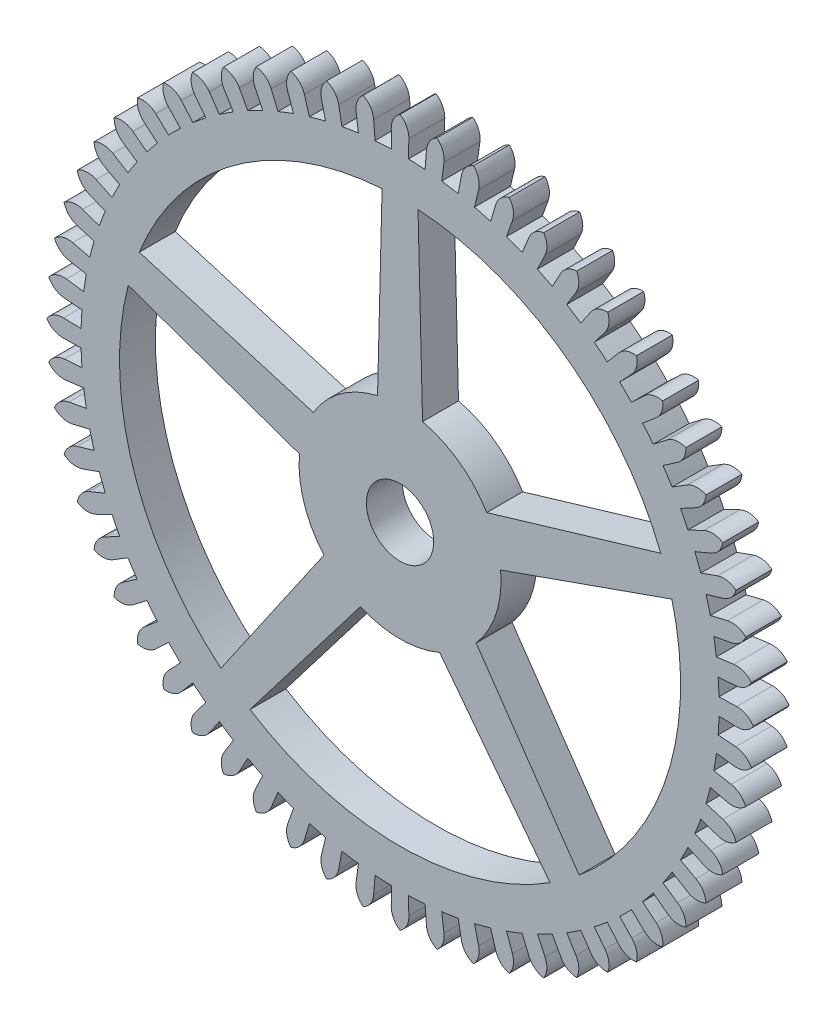
from build123d import *

# Parameters (mm, degrees)
SKETCH1_R           = 0.75
BOSS_EXTRUDE1_DEPTH = 0.8


with BuildPart() as part:
    # Sketch1 → Boss-Extrude1 (new body)
    with BuildSketch(Plane.XY):
        with BuildLine():
            ThreePointArc((0.196333177, 7.497429778), (0.146842868, 7.709365809), (0, 7.87))
            ThreePointArc((0, 7.87), (-0.146842868, 7.709365809), (-0.196333177, 7.497429778))
            Line((-0.196333177, 7.497429778), (-0.186053172, 7.104864355))
            ThreePointArc((-0.186053172, 7.104864355), (-0.371967342, 7.097559692), (-0.5576266, 7.085391017))
            Line((-0.5576266, 7.085391017), (-0.58843717, 7.476880479))
            ThreePointArc((-0.58843717, 7.476880479), (-0.659809713, 7.682482355), (-0.822639006, 7.826887317))
            ThreePointArc((-0.822639006, 7.826887317), (-0.951886609, 7.651783837), (-0.978952457, 7.435835668))
            Line((-0.978952457, 7.435835668), (-0.927694506, 7.046495313))
            ThreePointArc((-0.927694506, 7.046495313), (-1.111826673, 7.019797343), (-1.295196897, 6.988288652))
            Line((-1.295196897, 6.988288652), (-1.366760476, 7.374412912))
            ThreePointArc((-1.366760476, 7.374412912), (-1.459233281, 7.571428018), (-1.636265007, 7.698021618))
            ThreePointArc((-1.636265007, 7.698021618), (-1.74650128, 7.51036732), (-1.750846128, 7.292772987))
            Line((-1.750846128, 7.292772987), (-1.659171825, 6.910923393))
            ThreePointArc((-1.659171825, 6.910923393), (-1.839504599, 6.865124625), (-2.018576747, 6.814621135))
            Line((-2.018576747, 6.814621135), (-2.130109268, 7.191149735))
            ThreePointArc((-2.130109268, 7.191149735), (-2.242669184, 7.377419531), (-2.431963746, 7.484814783))
            ThreePointArc((-2.431963746, 7.484814783), (-2.521980918, 7.286665647), (-2.503557163, 7.069809158))
            Line((-2.503557163, 7.069809158), (-2.37247091, 6.69963395))
            ThreePointArc((-2.37247091, 6.69963395), (-2.547028528, 6.635236165), (-2.719840647, 6.566291202))
            Line((-2.719840647, 6.566291202), (-2.870120138, 6.929098816))
            ThreePointArc((-2.870120138, 6.929098816), (-3.001533934, 7.102582491), (-3.201017381, 7.189602752))
            ThreePointArc((-3.201017381, 7.189602752), (-3.269829205, 6.98312974), (-3.228838702, 6.769387021))
            Line((-3.228838702, 6.769387021), (-3.059776708, 6.414941916))
            ThreePointArc((-3.059776708, 6.414941916), (-3.226646679, 6.332650669), (-3.391305404, 6.246019608))
            Line((-3.391305404, 6.246019608), (-3.57868537, 6.59113124))
            ThreePointArc((-3.57868537, 6.59113124), (-3.72751325, 6.749928072), (-3.935, 6.815619928))
            ThreePointArc((-3.935, 6.815619928), (-3.981852559, 6.603085203), (-3.918744408, 6.394798063))
            Line((-3.918744408, 6.394798063), (-3.713558951, 6.059966436))
            ThreePointArc((-3.713558951, 6.059966436), (-3.870913014, 5.960683328), (-4.02561431, 5.857315317))
            Line((-4.02561431, 5.857315317), (-4.248041777, 6.180949851))
            ThreePointArc((-4.248041777, 6.180949851), (-4.412653151, 6.323320027), (-4.625869936, 6.366963746))
            ThreePointArc((-4.625869936, 6.366963746), (-4.650249903, 6.150695882), (-4.565715531, 5.950146359))
            Line((-4.565715531, 5.950146359), (-4.326654666, 5.638596696))
            ThreePointArc((-4.326654666, 5.638596696), (-4.472768815, 5.523409492), (-4.615817742, 5.404437053))
            Line((-4.615817742, 5.404437053), (-4.870855749, 5.703048682))
            ThreePointArc((-4.870855749, 5.703048682), (-5.0494471, 5.827432366), (-5.266057872, 5.848549777))
            ThreePointArc((-5.266057872, 5.848549777), (-5.267698136, 5.630918251), (-5.162663719, 5.440303606))
            Line((-5.162663719, 5.440303606), (-4.892346646, 5.15544931))
            ThreePointArc((-4.892346646, 5.15544931), (-5.025620026, 5.025620026), (-5.15544931, 4.892346646))
            Line((-5.15544931, 4.892346646), (-5.440303606, 5.162663719))
            ThreePointArc((-5.440303606, 5.162663719), (-5.630918251, 5.267698136), (-5.848549777, 5.266057872))
            ThreePointArc((-5.848549777, 5.266057872), (-5.827432366, 5.0494471), (-5.703048682, 4.870855749))
            Line((-5.703048682, 4.870855749), (-5.404437053, 4.615817742))
            ThreePointArc((-5.404437053, 4.615817742), (-5.523409492, 4.472768815), (-5.638596696, 4.326654666))
            Line((-5.638596696, 4.326654666), (-5.950146359, 4.565715531))
            ThreePointArc((-5.950146359, 4.565715531), (-6.150695882, 4.650249903), (-6.366963746, 4.625869936))
            ThreePointArc((-6.366963746, 4.625869936), (-6.323320027, 4.412653151), (-6.180949851, 4.248041777))
            Line((-6.180949851, 4.248041777), (-5.857315317, 4.02561431))
            ThreePointArc((-5.857315317, 4.02561431), (-5.960683328, 3.870913014), (-6.059966436, 3.713558951))
            Line((-6.059966436, 3.713558951), (-6.394798063, 3.918744408))
            ThreePointArc((-6.394798063, 3.918744408), (-6.603085203, 3.981852559), (-6.815619928, 3.935))
            ThreePointArc((-6.815619928, 3.935), (-6.749928072, 3.72751325), (-6.59113124, 3.57868537))
            Line((-6.59113124, 3.57868537), (-6.246019608, 3.391305404))
            ThreePointArc((-6.246019608, 3.391305404), (-6.332650669, 3.226646679), (-6.414941916, 3.059776708))
            Line((-6.414941916, 3.059776708), (-6.769387021, 3.228838702))
            ThreePointArc((-6.769387021, 3.228838702), (-6.98312974, 3.269829205), (-7.189602752, 3.201017381))
            ThreePointArc((-7.189602752, 3.201017381), (-7.102582491, 3.001533934), (-6.929098816, 2.870120138))
            Line((-6.929098816, 2.870120138), (-6.566291202, 2.719840647))
            ThreePointArc((-6.566291202, 2.719840647), (-6.635236165, 2.547028528), (-6.69963395, 2.37247091))
            Line((-6.69963395, 2.37247091), (-7.069809158, 2.503557163))
            ThreePointArc((-7.069809158, 2.503557163), (-7.286665647, 2.521980918), (-7.484814783, 2.431963746))
            ThreePointArc((-7.484814783, 2.431963746), (-7.377419531, 2.242669184), (-7.191149735, 2.130109268))
            Line((-7.191149735, 2.130109268), (-6.814621135, 2.018576747))
            ThreePointArc((-6.814621135, 2.018576747), (-6.865124625, 1.839504599), (-6.910923393, 1.659171825))
            Line((-6.910923393, 1.659171825), (-7.292772987, 1.750846128))
            ThreePointArc((-7.292772987, 1.750846128), (-7.51036732, 1.74650128), (-7.698021618, 1.636265007))
            ThreePointArc((-7.698021618, 1.636265007), (-7.571428018, 1.459233281), (-7.374412912, 1.366760476))
            Line((-7.374412912, 1.366760476), (-6.988288652, 1.295196897))
            ThreePointArc((-6.988288652, 1.295196897), (-7.019797343, 1.111826673), (-7.046495313, 0.927694506))
            Line((-7.046495313, 0.927694506), (-7.435835668, 0.978952457))
            ThreePointArc((-7.435835668, 0.978952457), (-7.651783837, 0.951886609), (-7.826887317, 0.822639006))
            ThreePointArc((-7.826887317, 0.822639006), (-7.682482355, 0.659809713), (-7.476880479, 0.58843717))
            Line((-7.476880479, 0.58843717), (-7.085391017, 0.5576266))
            ThreePointArc((-7.085391017, 0.5576266), (-7.097559692, 0.371967342), (-7.104864355, 0.186053172))
            Line((-7.104864355, 0.186053172), (-7.497429779, 0.196333177))
            ThreePointArc((-7.497429779, 0.196333177), (-7.709365809, 0.146842868), (-7.87, 0))
            ThreePointArc((-7.87, 0), (-7.709365809, -0.146842868), (-7.497429779, -0.196333177))
            Line((-7.497429779, -0.196333177), (-7.104864355, -0.186053172))
            ThreePointArc((-7.104864355, -0.186053172), (-7.097559692, -0.371967342), (-7.085391017, -0.5576266))
            Line((-7.085391017, -0.5576266), (-7.476880479, -0.58843717))
            ThreePointArc((-7.476880479, -0.58843717), (-7.682482355, -0.659809713), (-7.826887317, -0.822639006))
            ThreePointArc((-7.826887317, -0.822639006), (-7.651783837, -0.951886609), (-7.435835668, -0.978952457))
            Line((-7.435835668, -0.978952457), (-7.046495313, -0.927694506))
            ThreePointArc((-7.046495313, -0.927694506), (-7.019797343, -1.111826673), (-6.988288652, -1.295196897))
            Line((-6.988288652, -1.295196897), (-7.374412912, -1.366760476))
            ThreePointArc((-7.374412912, -1.366760476), (-7.571428018, -1.459233281), (-7.698021618, -1.636265007))
            ThreePointArc((-7.698021618, -1.636265007), (-7.51036732, -1.74650128), (-7.292772987, -1.750846128))
            Line((-7.292772987, -1.750846128), (-6.910923393, -1.659171825))
            ThreePointArc((-6.910923393, -1.659171825), (-6.865124625, -1.839504599), (-6.814621135, -2.018576747))
            Line((-6.814621135, -2.018576747), (-7.191149735, -2.130109268))
            ThreePointArc((-7.191149735, -2.130109268), (-7.377419531, -2.242669184), (-7.484814783, -2.431963746))
            ThreePointArc((-7.484814783, -2.431963746), (-7.286665647, -2.521980918), (-7.069809158, -2.503557163))
            Line((-7.069809158, -2.503557163), (-6.69963395, -2.37247091))
            ThreePointArc((-6.69963395, -2.37247091), (-6.635236165, -2.547028528), (-6.566291202, -2.719840647))
            Line((-6.566291202, -2.719840647), (-6.929098816, -2.870120138))
            ThreePointArc((-6.929098816, -2.870120138), (-7.102582491, -3.001533934), (-7.189602752, -3.201017381))
            ThreePointArc((-7.189602752, -3.201017381), (-6.98312974, -3.269829205), (-6.769387021, -3.228838702))
            Line((-6.769387021, -3.228838702), (-6.414941916, -3.059776708))
            ThreePointArc((-6.414941916, -3.059776708), (-6.332650669, -3.226646679), (-6.246019608, -3.391305404))
            Line((-6.246019608, -3.391305404), (-6.59113124, -3.57868537))
            ThreePointArc((-6.59113124, -3.57868537), (-6.749928072, -3.72751325), (-6.815619928, -3.935))
            ThreePointArc((-6.815619928, -3.935), (-6.603085203, -3.981852559), (-6.394798063, -3.918744408))
            Line((-6.394798063, -3.918744408), (-6.059966436, -3.713558951))
            ThreePointArc((-6.059966436, -3.713558951), (-5.960683328, -3.870913014), (-5.857315317, -4.02561431))
            Line((-5.857315317, -4.02561431), (-6.180949851, -4.248041777))
            ThreePointArc((-6.180949851, -4.248041777), (-6.323320027, -4.412653151), (-6.366963746, -4.625869936))
            ThreePointArc((-6.366963746, -4.625869936), (-6.150695882, -4.650249903), (-5.950146359, -4.565715531))
            Line((-5.950146359, -4.565715531), (-5.638596696, -4.326654666))
            ThreePointArc((-5.638596696, -4.326654666), (-5.523409492, -4.472768815), (-5.404437053, -4.615817742))
            Line((-5.404437053, -4.615817742), (-5.703048682, -4.870855749))
            ThreePointArc((-5.703048682, -4.870855749), (-5.827432366, -5.0494471), (-5.848549777, -5.266057872))
            ThreePointArc((-5.848549777, -5.266057872), (-5.630918251, -5.267698136), (-5.440303606, -5.162663719))
            Line((-5.440303606, -5.162663719), (-5.15544931, -4.892346646))
            ThreePointArc((-5.15544931, -4.892346646), (-5.025620026, -5.025620026), (-4.892346646, -5.15544931))
            Line((-4.892346646, -5.15544931), (-5.162663719, -5.440303606))
            ThreePointArc((-5.162663719, -5.440303606), (-5.267698136, -5.630918251), (-5.266057872, -5.848549777))
            ThreePointArc((-5.266057872, -5.848549777), (-5.0494471, -5.827432366), (-4.870855749, -5.703048682))
            Line((-4.870855749, -5.703048682), (-4.615817742, -5.404437053))
            ThreePointArc((-4.615817742, -5.404437053), (-4.472768815, -5.523409492), (-4.326654666, -5.638596696))
            Line((-4.326654666, -5.638596696), (-4.565715531, -5.950146359))
            ThreePointArc((-4.565715531, -5.950146359), (-4.650249903, -6.150695882), (-4.625869936, -6.366963746))
            ThreePointArc((-4.625869936, -6.366963746), (-4.412653151, -6.323320027), (-4.248041777, -6.180949851))
            Line((-4.248041777, -6.180949851), (-4.02561431, -5.857315317))
            ThreePointArc((-4.02561431, -5.857315317), (-3.870913014, -5.960683328), (-3.713558951, -6.059966436))
            Line((-3.713558951, -6.059966436), (-3.918744408, -6.394798063))
            ThreePointArc((-3.918744408, -6.394798063), (-3.981852559, -6.603085203), (-3.935, -6.815619928))
            ThreePointArc((-3.935, -6.815619928), (-3.72751325, -6.749928072), (-3.57868537, -6.59113124))
            Line((-3.57868537, -6.59113124), (-3.391305404, -6.246019608))
            ThreePointArc((-3.391305404, -6.246019608), (-3.226646679, -6.332650669), (-3.059776708, -6.414941916))
            Line((-3.059776708, -6.414941916), (-3.228838702, -6.769387021))
            ThreePointArc((-3.228838702, -6.769387021), (-3.269829205, -6.98312974), (-3.201017381, -7.189602752))
            ThreePointArc((-3.201017381, -7.189602752), (-3.001533934, -7.102582491), (-2.870120138, -6.929098816))
            Line((-2.870120138, -6.929098816), (-2.719840647, -6.566291202))
            ThreePointArc((-2.719840647, -6.566291202), (-2.547028528, -6.635236165), (-2.37247091, -6.69963395))
            Line((-2.37247091, -6.69963395), (-2.503557163, -7.069809158))
            ThreePointArc((-2.503557163, -7.069809158), (-2.521980918, -7.286665647), (-2.431963746, -7.484814783))
            ThreePointArc((-2.431963746, -7.484814783), (-2.242669184, -7.377419531), (-2.130109268, -7.191149735))
            Line((-2.130109268, -7.191149735), (-2.018576747, -6.814621135))
            ThreePointArc((-2.018576747, -6.814621135), (-1.839504599, -6.865124625), (-1.659171825, -6.910923393))
            Line((-1.659171825, -6.910923393), (-1.750846128, -7.292772987))
            ThreePointArc((-1.750846128, -7.292772987), (-1.74650128, -7.51036732), (-1.636265007, -7.698021618))
            ThreePointArc((-1.636265007, -7.698021618), (-1.459233281, -7.571428018), (-1.366760476, -7.374412912))
            Line((-1.366760476, -7.374412912), (-1.295196897, -6.988288652))
            ThreePointArc((-1.295196897, -6.988288652), (-1.111826673, -7.019797343), (-0.927694506, -7.046495313))
            Line((-0.927694506, -7.046495313), (-0.978952457, -7.435835668))
            ThreePointArc((-0.978952457, -7.435835668), (-0.951886609, -7.651783837), (-0.822639006, -7.826887317))
            ThreePointArc((-0.822639006, -7.826887317), (-0.659809713, -7.682482355), (-0.58843717, -7.476880479))
            Line((-0.58843717, -7.476880479), (-0.5576266, -7.085391017))
            ThreePointArc((-0.5576266, -7.085391017), (-0.371967342, -7.097559692), (-0.186053172, -7.104864355))
            Line((-0.186053172, -7.104864355), (-0.196333177, -7.497429779))
            ThreePointArc((-0.196333177, -7.497429779), (-0.146842868, -7.709365809), (0, -7.87))
            ThreePointArc((0, -7.87), (0.146842868, -7.709365809), (0.196333177, -7.497429779))
            Line((0.196333177, -7.497429779), (0.186053172, -7.104864355))
            ThreePointArc((0.186053172, -7.104864355), (0.371967342, -7.097559692), (0.5576266, -7.085391017))
            Line((0.5576266, -7.085391017), (0.58843717, -7.476880479))
            ThreePointArc((0.58843717, -7.476880479), (0.659809713, -7.682482355), (0.822639006, -7.826887317))
            ThreePointArc((0.822639006, -7.826887317), (0.951886609, -7.651783837), (0.978952457, -7.435835668))
            Line((0.978952457, -7.435835668), (0.927694506, -7.046495313))
            ThreePointArc((0.927694506, -7.046495313), (1.111826673, -7.019797343), (1.295196897, -6.988288652))
            Line((1.295196897, -6.988288652), (1.366760476, -7.374412912))
            ThreePointArc((1.366760476, -7.374412912), (1.459233281, -7.571428018), (1.636265007, -7.698021618))
            ThreePointArc((1.636265007, -7.698021618), (1.74650128, -7.51036732), (1.750846128, -7.292772987))
            Line((1.750846128, -7.292772987), (1.659171825, -6.910923393))
            ThreePointArc((1.659171825, -6.910923393), (1.839504599, -6.865124625), (2.018576747, -6.814621135))
            Line((2.018576747, -6.814621135), (2.130109268, -7.191149735))
            ThreePointArc((2.130109268, -7.191149735), (2.242669184, -7.377419531), (2.431963746, -7.484814783))
            ThreePointArc((2.431963746, -7.484814783), (2.521980918, -7.286665647), (2.503557163, -7.069809158))
            Line((2.503557163, -7.069809158), (2.37247091, -6.69963395))
            ThreePointArc((2.37247091, -6.69963395), (2.547028528, -6.635236165), (2.719840647, -6.566291202))
            Line((2.719840647, -6.566291202), (2.870120138, -6.929098816))
            ThreePointArc((2.870120138, -6.929098816), (3.001533934, -7.102582491), (3.201017381, -7.189602752))
            ThreePointArc((3.201017381, -7.189602752), (3.269829205, -6.98312974), (3.228838702, -6.769387021))
            Line((3.228838702, -6.769387021), (3.059776708, -6.414941916))
            ThreePointArc((3.059776708, -6.414941916), (3.226646679, -6.332650669), (3.391305404, -6.246019608))
            Line((3.391305404, -6.246019608), (3.57868537, -6.59113124))
            ThreePointArc((3.57868537, -6.59113124), (3.72751325, -6.749928072), (3.935, -6.815619928))
            ThreePointArc((3.935, -6.815619928), (3.981852559, -6.603085203), (3.918744408, -6.394798063))
            Line((3.918744408, -6.394798063), (3.713558951, -6.059966436))
            ThreePointArc((3.713558951, -6.059966436), (3.870913014, -5.960683328), (4.02561431, -5.857315317))
            Line((4.02561431, -5.857315317), (4.248041777, -6.180949851))
            ThreePointArc((4.248041777, -6.180949851), (4.412653151, -6.323320027), (4.625869936, -6.366963746))
            ThreePointArc((4.625869936, -6.366963746), (4.650249903, -6.150695882), (4.565715531, -5.950146359))
            Line((4.565715531, -5.950146359), (4.326654666, -5.638596696))
            ThreePointArc((4.326654666, -5.638596696), (4.472768815, -5.523409492), (4.615817742, -5.404437053))
            Line((4.615817742, -5.404437053), (4.870855749, -5.703048682))
            ThreePointArc((4.870855749, -5.703048682), (5.0494471, -5.827432366), (5.266057872, -5.848549777))
            ThreePointArc((5.266057872, -5.848549777), (5.267698136, -5.630918251), (5.162663719, -5.440303606))
            Line((5.162663719, -5.440303606), (4.892346646, -5.15544931))
            ThreePointArc((4.892346646, -5.15544931), (5.025620026, -5.025620026), (5.15544931, -4.892346646))
            Line((5.15544931, -4.892346646), (5.440303606, -5.162663719))
            ThreePointArc((5.440303606, -5.162663719), (5.630918251, -5.267698136), (5.848549777, -5.266057872))
            ThreePointArc((5.848549777, -5.266057872), (5.827432366, -5.0494471), (5.703048682, -4.870855749))
            Line((5.703048682, -4.870855749), (5.404437053, -4.615817742))
            ThreePointArc((5.404437053, -4.615817742), (5.523409492, -4.472768815), (5.638596696, -4.326654666))
            Line((5.638596696, -4.326654666), (5.950146359, -4.565715531))
            ThreePointArc((5.950146359, -4.565715531), (6.150695882, -4.650249903), (6.366963746, -4.625869936))
            ThreePointArc((6.366963746, -4.625869936), (6.323320027, -4.412653151), (6.180949851, -4.248041777))
            Line((6.180949851, -4.248041777), (5.857315317, -4.02561431))
            ThreePointArc((5.857315317, -4.02561431), (5.960683328, -3.870913014), (6.059966436, -3.713558951))
            Line((6.059966436, -3.713558951), (6.394798063, -3.918744408))
            ThreePointArc((6.394798063, -3.918744408), (6.603085203, -3.981852559), (6.815619928, -3.935))
            ThreePointArc((6.815619928, -3.935), (6.749928072, -3.72751325), (6.59113124, -3.57868537))
            Line((6.59113124, -3.57868537), (6.246019608, -3.391305404))
            ThreePointArc((6.246019608, -3.391305404), (6.332650669, -3.226646679), (6.414941916, -3.059776708))
            Line((6.414941916, -3.059776708), (6.769387021, -3.228838702))
            ThreePointArc((6.769387021, -3.228838702), (6.98312974, -3.269829205), (7.189602752, -3.201017381))
            ThreePointArc((7.189602752, -3.201017381), (7.102582491, -3.001533934), (6.929098816, -2.870120138))
            Line((6.929098816, -2.870120138), (6.566291202, -2.719840647))
            ThreePointArc((6.566291202, -2.719840647), (6.635236165, -2.547028528), (6.69963395, -2.37247091))
            Line((6.69963395, -2.37247091), (7.069809158, -2.503557163))
            ThreePointArc((7.069809158, -2.503557163), (7.286665647, -2.521980918), (7.484814783, -2.431963746))
            ThreePointArc((7.484814783, -2.431963746), (7.377419531, -2.242669184), (7.191149735, -2.130109268))
            Line((7.191149735, -2.130109268), (6.814621135, -2.018576747))
            ThreePointArc((6.814621135, -2.018576747), (6.865124625, -1.839504599), (6.910923393, -1.659171825))
            Line((6.910923393, -1.659171825), (7.292772987, -1.750846128))
            ThreePointArc((7.292772987, -1.750846128), (7.51036732, -1.74650128), (7.698021618, -1.636265007))
            ThreePointArc((7.698021618, -1.636265007), (7.571428018, -1.459233281), (7.374412912, -1.366760476))
            Line((7.374412912, -1.366760476), (6.988288652, -1.295196897))
            ThreePointArc((6.988288652, -1.295196897), (7.019797343, -1.111826673), (7.046495313, -0.927694506))
            Line((7.046495313, -0.927694506), (7.435835668, -0.978952457))
            ThreePointArc((7.435835668, -0.978952457), (7.651783837, -0.951886609), (7.826887317, -0.822639006))
            ThreePointArc((7.826887317, -0.822639006), (7.682482355, -0.659809713), (7.476880479, -0.58843717))
            Line((7.476880479, -0.58843717), (7.085391017, -0.5576266))
            ThreePointArc((7.085391017, -0.5576266), (7.097559692, -0.371967342), (7.104864355, -0.186053172))
            Line((7.104864355, -0.186053172), (7.497429779, -0.196333177))
            ThreePointArc((7.497429779, -0.196333177), (7.709365809, -0.146842868), (7.87, 0))
            ThreePointArc((7.87, 0), (7.709365809, 0.146842868), (7.497429779, 0.196333177))
            Line((7.497429779, 0.196333177), (7.104864355, 0.186053172))
            ThreePointArc((7.104864355, 0.186053172), (7.097559692, 0.371967342), (7.085391017, 0.5576266))
            Line((7.085391017, 0.5576266), (7.476880479, 0.58843717))
            ThreePointArc((7.476880479, 0.58843717), (7.682482355, 0.659809713), (7.826887317, 0.822639006))
            ThreePointArc((7.826887317, 0.822639006), (7.651783837, 0.951886609), (7.435835668, 0.978952457))
            Line((7.435835668, 0.978952457), (7.046495313, 0.927694506))
            ThreePointArc((7.046495313, 0.927694506), (7.019797343, 1.111826673), (6.988288652, 1.295196897))
            Line((6.988288652, 1.295196897), (7.374412912, 1.366760476))
            ThreePointArc((7.374412912, 1.366760476), (7.571428018, 1.459233281), (7.698021618, 1.636265007))
            ThreePointArc((7.698021618, 1.636265007), (7.51036732, 1.74650128), (7.292772987, 1.750846128))
            Line((7.292772987, 1.750846128), (6.910923393, 1.659171825))
            ThreePointArc((6.910923393, 1.659171825), (6.865124625, 1.839504599), (6.814621135, 2.018576747))
            Line((6.814621135, 2.018576747), (7.191149735, 2.130109268))
            ThreePointArc((7.191149735, 2.130109268), (7.377419531, 2.242669184), (7.484814783, 2.431963746))
            ThreePointArc((7.484814783, 2.431963746), (7.286665647, 2.521980918), (7.069809158, 2.503557163))
            Line((7.069809158, 2.503557163), (6.69963395, 2.37247091))
            ThreePointArc((6.69963395, 2.37247091), (6.635236165, 2.547028528), (6.566291202, 2.719840647))
            Line((6.566291202, 2.719840647), (6.929098816, 2.870120138))
            ThreePointArc((6.929098816, 2.870120138), (7.102582491, 3.001533934), (7.189602752, 3.201017381))
            ThreePointArc((7.189602752, 3.201017381), (6.98312974, 3.269829205), (6.769387021, 3.228838702))
            Line((6.769387021, 3.228838702), (6.414941916, 3.059776708))
            ThreePointArc((6.414941916, 3.059776708), (6.332650669, 3.226646679), (6.246019608, 3.391305404))
            Line((6.246019608, 3.391305404), (6.59113124, 3.57868537))
            ThreePointArc((6.59113124, 3.57868537), (6.749928072, 3.72751325), (6.815619928, 3.935))
            ThreePointArc((6.815619928, 3.935), (6.603085203, 3.981852559), (6.394798063, 3.918744408))
            Line((6.394798063, 3.918744408), (6.059966436, 3.713558951))
            ThreePointArc((6.059966436, 3.713558951), (5.960683328, 3.870913014), (5.857315317, 4.02561431))
            Line((5.857315317, 4.02561431), (6.180949851, 4.248041777))
            ThreePointArc((6.180949851, 4.248041777), (6.323320027, 4.412653151), (6.366963746, 4.625869936))
            ThreePointArc((6.366963746, 4.625869936), (6.150695882, 4.650249903), (5.950146359, 4.565715531))
            Line((5.950146359, 4.565715531), (5.638596696, 4.326654666))
            ThreePointArc((5.638596696, 4.326654666), (5.523409492, 4.472768815), (5.404437053, 4.615817742))
            Line((5.404437053, 4.615817742), (5.703048682, 4.870855749))
            ThreePointArc((5.703048682, 4.870855749), (5.827432366, 5.0494471), (5.848549777, 5.266057872))
            ThreePointArc((5.848549777, 5.266057872), (5.630918251, 5.267698136), (5.440303606, 5.162663719))
            Line((5.440303606, 5.162663719), (5.15544931, 4.892346646))
            ThreePointArc((5.15544931, 4.892346646), (5.025620026, 5.025620026), (4.892346646, 5.15544931))
            Line((4.892346646, 5.15544931), (5.162663719, 5.440303606))
            ThreePointArc((5.162663719, 5.440303606), (5.267698136, 5.630918251), (5.266057872, 5.848549777))
            ThreePointArc((5.266057872, 5.848549777), (5.0494471, 5.827432366), (4.870855749, 5.703048682))
            Line((4.870855749, 5.703048682), (4.615817742, 5.404437053))
            ThreePointArc((4.615817742, 5.404437053), (4.472768815, 5.523409492), (4.326654666, 5.638596696))
            Line((4.326654666, 5.638596696), (4.565715531, 5.950146359))
            ThreePointArc((4.565715531, 5.950146359), (4.650249903, 6.150695882), (4.625869936, 6.366963746))
            ThreePointArc((4.625869936, 6.366963746), (4.412653151, 6.323320027), (4.248041777, 6.180949851))
            Line((4.248041777, 6.180949851), (4.02561431, 5.857315317))
            ThreePointArc((4.02561431, 5.857315317), (3.870913014, 5.960683328), (3.713558951, 6.059966436))
            Line((3.713558951, 6.059966436), (3.918744408, 6.394798063))
            ThreePointArc((3.918744408, 6.394798063), (3.981852559, 6.603085203), (3.935, 6.815619928))
            ThreePointArc((3.935, 6.815619928), (3.72751325, 6.749928072), (3.57868537, 6.59113124))
            Line((3.57868537, 6.59113124), (3.391305404, 6.246019608))
            ThreePointArc((3.391305404, 6.246019608), (3.226646679, 6.332650669), (3.059776708, 6.414941916))
            Line((3.059776708, 6.414941916), (3.228838702, 6.769387021))
            ThreePointArc((3.228838702, 6.769387021), (3.269829205, 6.98312974), (3.201017381, 7.189602752))
            ThreePointArc((3.201017381, 7.189602752), (3.001533934, 7.102582491), (2.870120138, 6.929098816))
            Line((2.870120138, 6.929098816), (2.719840647, 6.566291202))
            ThreePointArc((2.719840647, 6.566291202), (2.547028528, 6.635236165), (2.37247091, 6.69963395))
            Line((2.37247091, 6.69963395), (2.503557163, 7.069809158))
            ThreePointArc((2.503557163, 7.069809158), (2.521980918, 7.286665647), (2.431963746, 7.484814783))
            ThreePointArc((2.431963746, 7.484814783), (2.242669184, 7.377419531), (2.130109268, 7.191149735))
            Line((2.130109268, 7.191149735), (2.018576747, 6.814621135))
            ThreePointArc((2.018576747, 6.814621135), (1.839504599, 6.865124625), (1.659171825, 6.910923393))
            Line((1.659171825, 6.910923393), (1.750846128, 7.292772987))
            ThreePointArc((1.750846128, 7.292772987), (1.74650128, 7.51036732), (1.636265007, 7.698021618))
            ThreePointArc((1.636265007, 7.698021618), (1.459233281, 7.571428018), (1.366760476, 7.374412912))
            Line((1.366760476, 7.374412912), (1.295196897, 6.988288652))
            ThreePointArc((1.295196897, 6.988288652), (1.111826673, 7.019797343), (0.927694506, 7.046495313))
            Line((0.927694506, 7.046495313), (0.978952457, 7.435835668))
            ThreePointArc((0.978952457, 7.435835668), (0.951886609, 7.651783837), (0.822639006, 7.826887317))
            ThreePointArc((0.822639006, 7.826887317), (0.659809713, 7.682482355), (0.58843717, 7.476880479))
            Line((0.58843717, 7.476880479), (0.5576266, 7.085391017))
            ThreePointArc((0.5576266, 7.085391017), (0.371967342, 7.097559692), (0.186053172, 7.104864355))
            Line((0.186053172, 7.104864355), (0.196333177, 7.497429778))
        make_face()
        with BuildLine():
            ThreePointArc((1.931119068, 1.154677073), (1.322516818, 1.820288237), (0.501414545, 2.193418212))
            Line((0.501414545, 2.193418212), (0.400320843, 6.237166281))
            ThreePointArc((0.400320843, 6.237166281), (3.673657827, 5.056356215), (5.808191692, 2.308118124))
            Line((5.808191692, 2.308118124), (1.931119068, 1.154677073))
        make_face(mode=Mode.SUBTRACT)
        with BuildLine():
            Line((2.241010299, 0.200929933), (6.055603579, 1.546662631))
            ThreePointArc((6.055603579, 1.546662631), (5.944103227, -1.931356215), (3.989980722, -4.810670831))
            Line((3.989980722, -4.810670831), (1.694911765, -1.479788535))
            ThreePointArc((1.694911765, -1.479788535), (2.139877162, -0.695288237), (2.241010299, 0.200929933))
        make_face(mode=Mode.SUBTRACT)
        with BuildLine():
            ThreePointArc((-0.883605989, -2.069236684), (0, -2.25), (0.883605989, -2.069236684))
            Line((0.883605989, -2.069236684), (3.342247991, -5.281276206))
            ThreePointArc((3.342247991, -5.281276206), (0, -6.25), (-3.342247991, -5.281276206))
            Line((-3.342247991, -5.281276206), (-0.883605989, -2.069236684))
        make_face(mode=Mode.SUBTRACT)
        with BuildLine():
            ThreePointArc((-2.241010299, 0.200929933), (-2.139877162, -0.695288237), (-1.694911765, -1.479788535))
            Line((-1.694911765, -1.479788535), (-3.989980722, -4.810670831))
            ThreePointArc((-3.989980722, -4.810670831), (-5.944103227, -1.931356215), (-6.055603579, 1.546662631))
            Line((-6.055603579, 1.546662631), (-2.241010299, 0.200929933))
        make_face(mode=Mode.SUBTRACT)
        with BuildLine():
            ThreePointArc((-0.501414545, 2.193418212), (-1.322516818, 1.820288237), (-1.931119068, 1.154677073))
            Line((-1.931119068, 1.154677073), (-5.808191692, 2.308118124))
            ThreePointArc((-5.808191692, 2.308118124), (-3.673657827, 5.056356215), (-0.400320843, 6.237166281))
            Line((-0.400320843, 6.237166281), (-0.501414545, 2.193418212))
        make_face(mode=Mode.SUBTRACT)
        Circle(SKETCH1_R, mode=Mode.SUBTRACT)
    extrude(amount=-BOSS_EXTRUDE1_DEPTH)


solid = part.part
